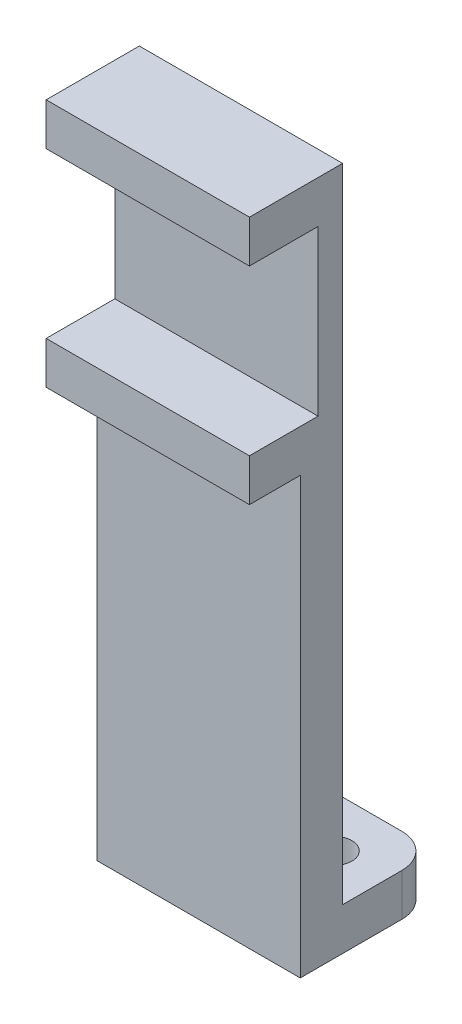
from build123d import *

# Parameters (mm, degrees)
SKETCH1_W           = 12
SKETCH1_H           = 8
BOSS_EXTRUDE1_DEPTH = 2.5
FILLET1_R           = 2
SKETCH2_R           = 1.05
CUT_EXTRUDE1_DEPTH  = 2.5
SKETCH3_W           = 12
SKETCH3_H           = 2.5
BOSS_EXTRUDE2_DEPTH = 37.9
SKETCH5_W           = 12
SKETCH5_H           = 2.5
BOSS_EXTRUDE4_DEPTH = 3
SKETCH6_W           = 12
SKETCH6_H           = 2.5
BOSS_EXTRUDE5_DEPTH = 3
SKETCH7_W           = 1.05
SKETCH7_H           = 9.7
CUT_EXTRUDE2_DEPTH  = 15


with BuildPart() as part:
    # Sketch1 → Boss-Extrude1 (new body)
    with BuildSketch(Plane(origin=(0, 0, 0), x_dir=(1, 0, 0), z_dir=(0, 1, 0))):
        Rectangle(SKETCH1_W, SKETCH1_H)
    extrude(amount=BOSS_EXTRUDE1_DEPTH)

    # Fillet1
    fillet1_edges = [part.edges().sort_by_distance(p)[0] for p in [
        (-6, 1.25, -4),
        (6, 1.25, -4),
    ]]
    fillet(fillet1_edges, radius=FILLET1_R)

    # Sketch2 → Cut-Extrude1 (cut)
    with BuildSketch(Plane(origin=(0, 2.5, 0), x_dir=(1, 0, 0), z_dir=(0, 1, 0))):
        with Locations(Location((3, 1, 0), (0, 0, 270))):
            Circle(SKETCH2_R)
        with Locations(Location((-3, 1, 0), (0, 0, 270))):
            Circle(SKETCH2_R)
    extrude(amount=-CUT_EXTRUDE1_DEPTH, mode=Mode.SUBTRACT)

    # Sketch3 → Boss-Extrude2 (add)
    with BuildSketch(Plane(origin=(0, 2.5, 0), x_dir=(1, 0, 0), z_dir=(0, 1, 0))):
        with Locations((0, -2.75)):
            Rectangle(SKETCH3_W, SKETCH3_H)
    extrude(amount=BOSS_EXTRUDE2_DEPTH)

    # Sketch5 → Boss-Extrude4 (add)
    with BuildSketch(Plane.XY.offset(4)):
        with Locations((0, 39.15)):
            Rectangle(SKETCH5_W, SKETCH5_H)
    extrude(amount=BOSS_EXTRUDE4_DEPTH)

    # Sketch6 → Boss-Extrude5 (add)
    with BuildSketch(Plane.XY.offset(4)):
        with Locations((0, 26.95)):
            Rectangle(SKETCH6_W, SKETCH6_H)
    extrude(amount=BOSS_EXTRUDE5_DEPTH)

    # Sketch7 → Cut-Extrude2 (cut)
    with BuildSketch(Plane.ZY.offset(6)):
        with Locations((3.475, 33.05)):
            Rectangle(SKETCH7_W, SKETCH7_H)
    extrude(amount=-CUT_EXTRUDE2_DEPTH, mode=Mode.SUBTRACT)


solid = part.part
